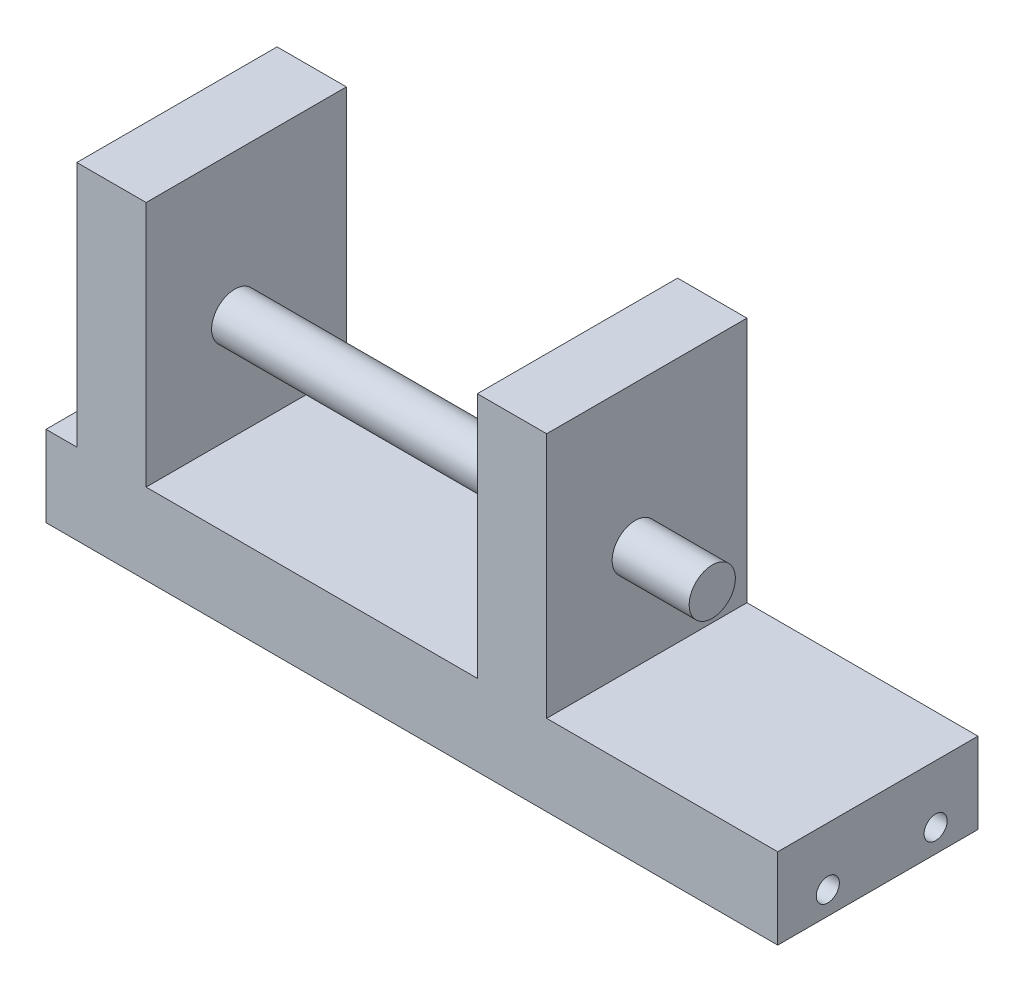
from build123d import *

# Parameters (mm, degrees)
SKETCH_1_W      = 26
SKETCH_1_H      = 10.5
SKETCH_1_R      = 1.5
EXTRUDE_1_DEPTH = 95
SKETCH_2_W      = 9
SKETCH_2_H      = 26
EXTRUDE_2_DEPTH = 32
SKETCH_4_R      = 3
EXTRUDE_3_DEPTH = 52
EXTRUDE_START   = 10
SKETCH_4_5_R    = 3
EXTRUDE_4_DEPTH = 10


with BuildPart() as part:
    # 草图1 → 凸台-拉伸1 (new body)
    with BuildSketch(Plane(origin=(0, 0, 0), x_dir=(0, 0, -1), z_dir=(1, 0, 0))):
        with Locations((-13, 5.25)):
            Rectangle(SKETCH_1_W, SKETCH_1_H)
        with Locations((-19.5, 3)):
            Circle(SKETCH_1_R, mode=Mode.SUBTRACT)
        with Locations((-5.5, 3)):
            Circle(SKETCH_1_R, mode=Mode.SUBTRACT)
    extrude(amount=-EXTRUDE_1_DEPTH)

    # 草图2 → 凸台-拉伸2 (add)
    with BuildSketch(Plane(origin=(0, 10.5, 0), x_dir=(1, 0, 0), z_dir=(0, 1, 0))):
        with Locations((-34.5, -13)):
            Rectangle(SKETCH_2_W, SKETCH_2_H)
        with Locations((-86.5, -13)):
            Rectangle(SKETCH_2_W, SKETCH_2_H)
    extrude(amount=EXTRUDE_2_DEPTH)

    # 草图4 → 凸台-拉伸3 (add)
    with BuildSketch(Plane(origin=(-30, 0, 0), x_dir=(0, 0, -1), z_dir=(1, 0, 0))):
        with Locations((-14.5, 24)):
            Circle(SKETCH_4_R)
    extrude(amount=-EXTRUDE_3_DEPTH)

    # 草图4<5> → 凸台-拉伸4 (add)
    with BuildSketch(Plane(origin=(-30, 0, 0), x_dir=(0, 0, -1), z_dir=(1, 0, 0)).offset(EXTRUDE_START)):
        with Locations((-14.5, 24)):
            Circle(SKETCH_4_5_R)
    extrude(amount=-EXTRUDE_4_DEPTH)


solid = part.part
